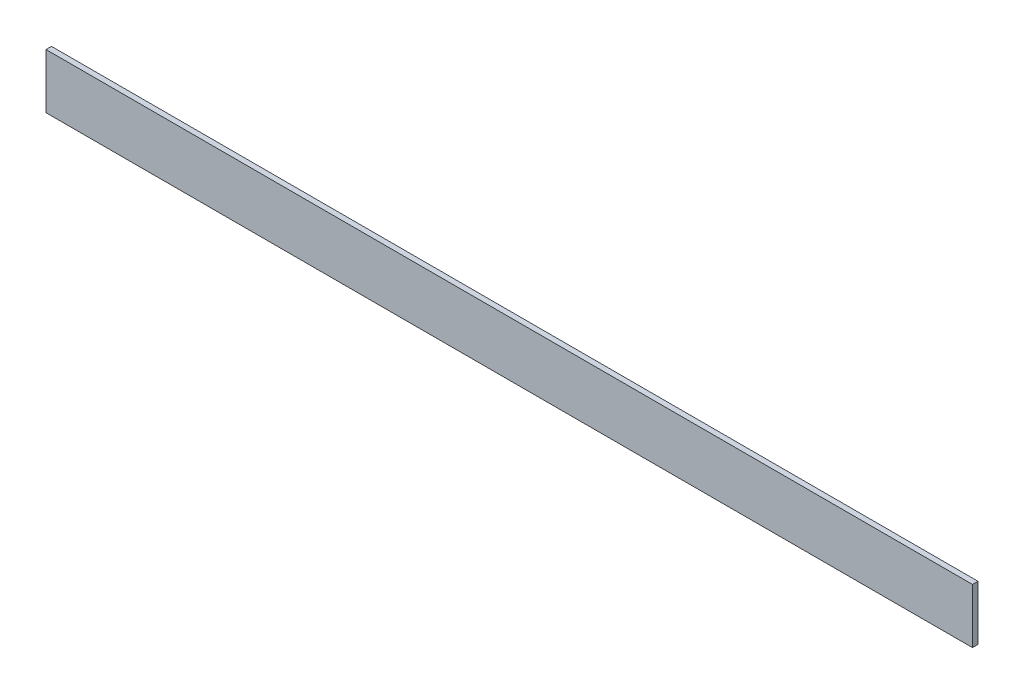
from build123d import *

# Parameters (mm, degrees)
SKETCH1_W           = 177.8
SKETCH1_H           = 10.5029
BOSS_EXTRUDE1_DEPTH = 1.0541


with BuildPart() as part:
    # Sketch1 → Boss-Extrude1 (new body)
    with BuildSketch(Plane.XY):
        with Locations((88.9, 5.25145)):
            Rectangle(SKETCH1_W, SKETCH1_H)
    extrude(amount=BOSS_EXTRUDE1_DEPTH)


solid = part.part
